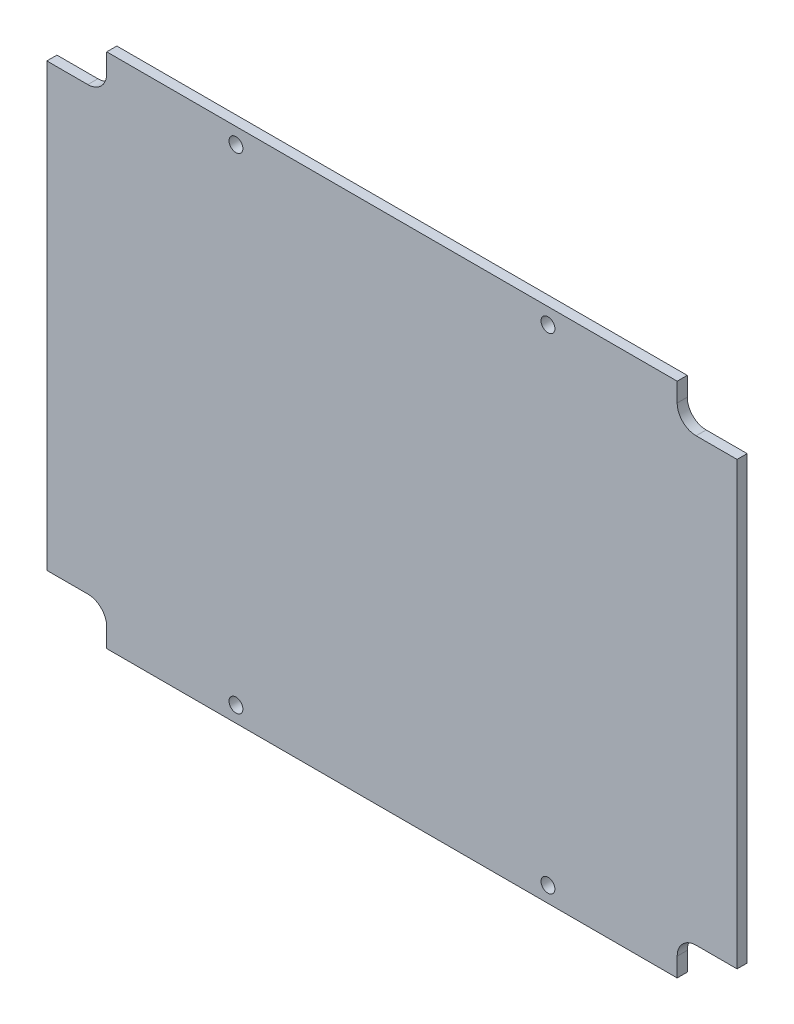
from build123d import *

# Parameters (mm, degrees)
SKETCH1_R           = 1.1
BOSS_EXTRUDE1_DEPTH = 1.6
FILLET1_R           = 3


with BuildPart() as part:
    # Sketch1 → Boss-Extrude1 (new body)
    with BuildSketch(Plane.XY):
        Polygon((54.006358498, 79.95185693), (44.506358498, 79.95185693), (44.506358498, 85.95185693), (-45.993641502, 85.95185693), (-45.993641502, 79.95185693), (-55.493641502, 79.95185693), (-55.493641502, 9.95185693), (-45.993641502, 9.95185693), (-45.993641502, 3.95185693), (44.506358498, 3.95185693), (44.506358498, 9.95185693), (54.006358498, 9.95185693), align=None)
        with Locations((-25.493641502, 83.45185693)):
            Circle(SKETCH1_R, mode=Mode.SUBTRACT)
        with Locations((24.006358498, 83.45185693)):
            Circle(SKETCH1_R, mode=Mode.SUBTRACT)
        with Locations((24.006358498, 6.45185693)):
            Circle(SKETCH1_R, mode=Mode.SUBTRACT)
        with Locations((-25.493641502, 6.45185693)):
            Circle(SKETCH1_R, mode=Mode.SUBTRACT)
    extrude(amount=BOSS_EXTRUDE1_DEPTH)

    # Fillet1
    fillet1_edges = [part.edges().sort_by_distance(p)[0] for p in [
        (44.506358498, 9.95185693, 0.8),
        (-45.993641502, 9.95185693, 0.8),
        (-45.993641502, 79.95185693, 0.8),
        (44.506358498, 79.95185693, 0.8),
    ]]
    fillet(fillet1_edges, radius=FILLET1_R)


solid = part.part
